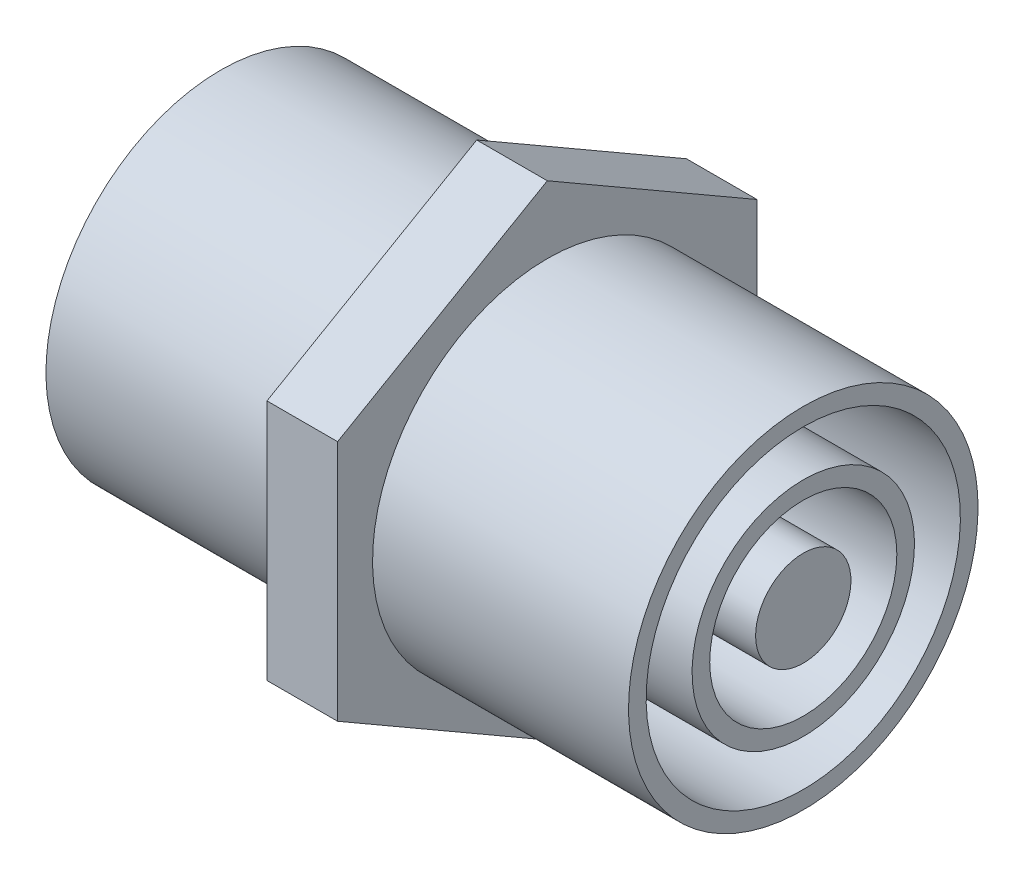
from build123d import *

# Parameters (mm, degrees)
BOSS_EXTRUDE1_DEPTH = 1


with BuildPart() as part:
    # Sketch1 → Revolve1 (revolve)
    with BuildSketch(Plane.XY):
        Polygon((0, 0), (0, 1.35), (7.25, 1.35), (7.25, 2.65), (0, 2.65), (0, 3.15), (7.25, 3.15), (7.25, 4.45), (0, 4.45), (0, 4.95), (7.25, 4.95), (7.25, 5.85), (8.25, 5.85), (8.25, 0), align=None)
    revolve(axis=Axis((8.25, 0, 0), (-1, 0, 0)))

    # Sketch2 → Boss-Extrude1 (add)
    with BuildSketch(Plane(origin=(8.25, 0, 0), x_dir=(0, 0, -1), z_dir=(1, 0, 0))):
        Polygon((5.94, -3.429460599), (5.94, 3.429460599), (0, 6.858921198), (-5.94, 3.429460599), (-5.94, -3.429460599), (0, -6.858921198), align=None)
    extrude(amount=-BOSS_EXTRUDE1_DEPTH)

    # Mirror1: part across face


with BuildPart() as part_1:
    add(part.part)
    add(part.part.mirror(Plane(origin=(8.25, 0, 0), x_dir=(0, 0, 1), z_dir=(1, 0, 0))))


solid = part_1.part
